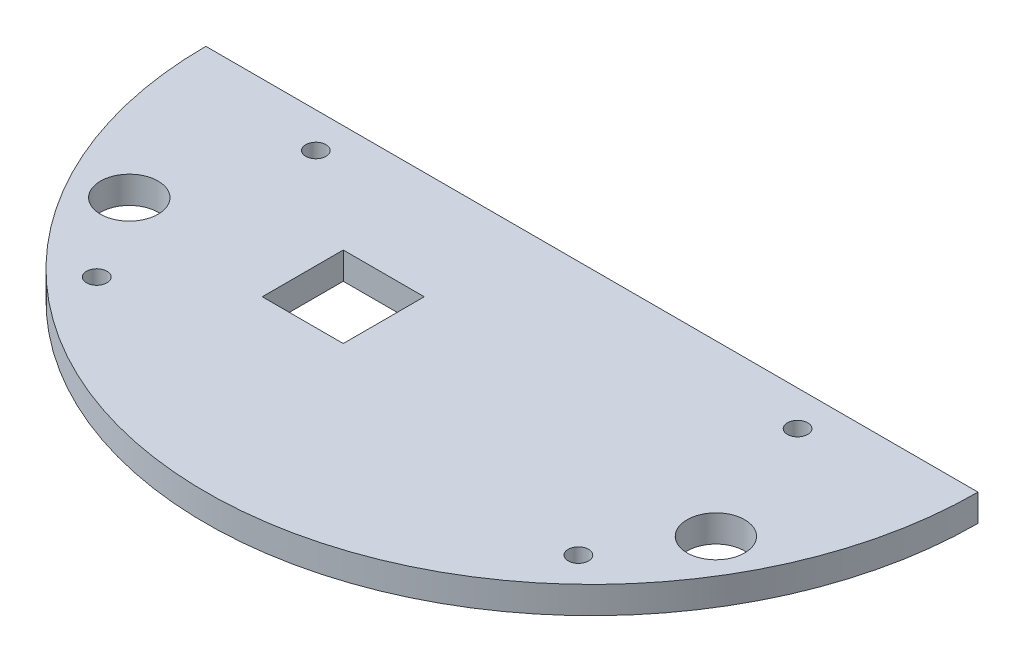
from build123d import *

# Parameters (mm, degrees)
ESQUISSE1_R             = 4.25
ESQUISSE1_W             = 62.5
ESQUISSE1_H             = 25
BOSS_EXTRU_1_DEPTH      = 4
ESQUISSE2_R             = 1.5
ENL_V_MAT_EXTRU_1_DEPTH = 81.709355096
ESQUISSE3_W             = 66.086844216
ESQUISSE3_H             = 27.920410929
BOSS_EXTRU_2_DEPTH      = 4
ESQUISSE5_W             = 11.958205263
ESQUISSE5_H             = 11.958205263
ENL_V_MAT_EXTRU_2_DEPTH = 81.709355096


with BuildPart() as part:
    # Esquisse1 → Boss.-Extru.1 (new body)
    with BuildSketch(Plane(origin=(0, 0, 0), x_dir=(1, 0, 0), z_dir=(0, 1, 0))):
        with BuildLine():
            Line((-57, 0), (57, 0))
            ThreePointArc((57, 0), (0, -57), (-57, 0))
        make_face()
        with Locations(Location((-43.301270189, -25, 0), (0, 0, 270))):
            Circle(ESQUISSE1_R, mode=Mode.SUBTRACT)
        with Locations(Location((43.301270189, -25, 0), (0, 0, 270))):
            Circle(ESQUISSE1_R, mode=Mode.SUBTRACT)
        with Locations((0, -22.5)):
            Rectangle(ESQUISSE1_W, ESQUISSE1_H, mode=Mode.SUBTRACT)
    extrude(amount=BOSS_EXTRU_1_DEPTH)

    # Esquisse2 → Enlèv. mat.-Extru.1 (cut, through all)
    with BuildSketch(Plane(origin=(0, 4, 0), x_dir=(1, 0, 0), z_dir=(0, 1, 0))):
        with Locations(Location((-35.557071612, -37.554578926, 0), (0, 0, 270))):
            Circle(ESQUISSE2_R)
        with Locations(Location((-35.557071612, -5.198506408, 0), (0, 0, 270))):
            Circle(ESQUISSE2_R)
        with Locations(Location((35.557071612, -5.198506408, 0), (0, 0, 270))):
            Circle(ESQUISSE2_R)
        with Locations(Location((35.557071612, -37.554578926, 0), (0, 0, 270))):
            Circle(ESQUISSE2_R)
    extrude(amount=-ENL_V_MAT_EXTRU_1_DEPTH, mode=Mode.SUBTRACT)

    # Esquisse3 → Boss.-Extru.2 (add)
    with BuildSketch(Plane(origin=(0, 4, 0), x_dir=(1, 0, 0), z_dir=(0, 1, 0))):
        with Locations((0, -22.864687702)):
            Rectangle(ESQUISSE3_W, ESQUISSE3_H)
    extrude(amount=-BOSS_EXTRU_2_DEPTH)

    # Esquisse5 → Enlèv. mat.-Extru.2 (cut, through all)
    with BuildSketch(Plane(origin=(0, 4, 0), x_dir=(1, 0, 0), z_dir=(0, 1, 0))):
        with Locations((-14.835187955, -21.879845073)):
            Rectangle(ESQUISSE5_W, ESQUISSE5_H)
    extrude(amount=-ENL_V_MAT_EXTRU_2_DEPTH, mode=Mode.SUBTRACT)


solid = part.part
